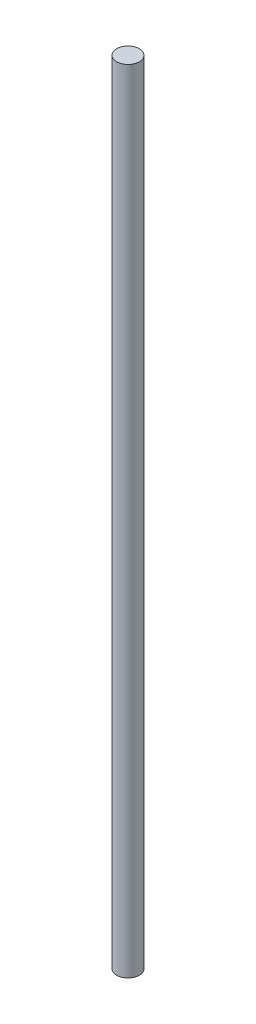
from build123d import *

# Parameters (mm, degrees)
ESBO_O1_R                = 0.5
RESSALTO_EXTRUS_O1_DEPTH = 35


with BuildPart() as part:
    # Esboço1 → Ressalto-extrusão1 (new body)
    with BuildSketch(Plane(origin=(0, 0, 0), x_dir=(1, 0, 0), z_dir=(0, 1, 0))):
        with Locations(Location((0, 0, 0), (0, 0, 270))):
            Circle(ESBO_O1_R)
    extrude(amount=RESSALTO_EXTRUS_O1_DEPTH)


solid = part.part
